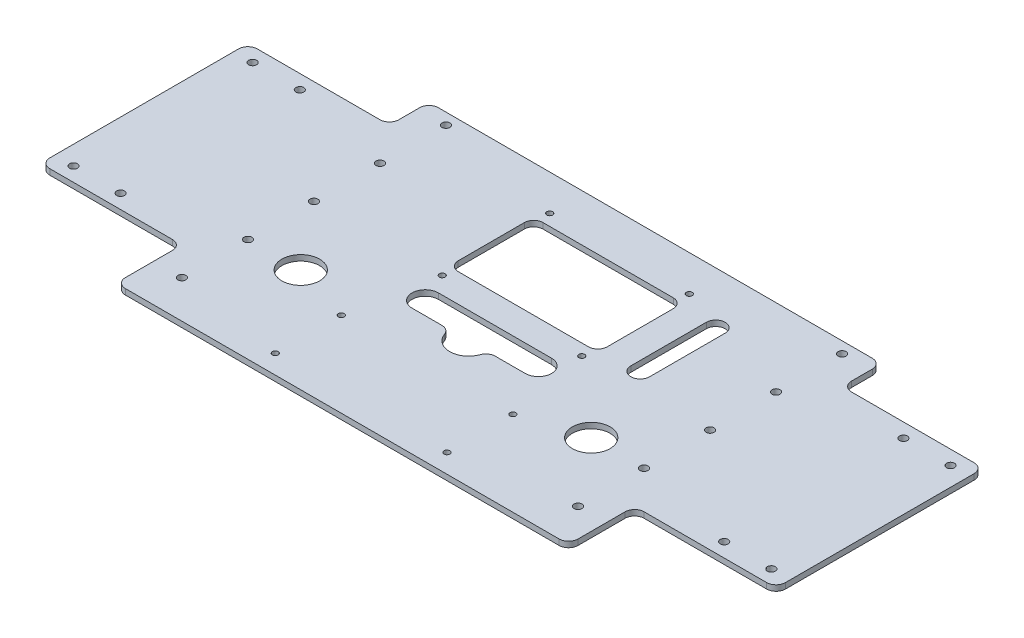
from build123d import *

# Parameters (mm, degrees)
SKETCH_1_W          = 240
SKETCH_1_H          = 166
EXTRUDE_1230_DEPTH  = 3
SKETCH_4_R          = 2.1
SKETCH_4_R_2        = 1.55
CUT_EXTRUDE_3_DEPTH = 251.068459046
SKETCH_5_R          = 1.55
SKETCH_5_R_2        = 10
SKETCH_5_W          = 79
SKETCH_5_H          = 45
CUT_EXTRUDE_4_DEPTH = 251.068459046
SKETCH_6_W          = 75
SKETCH_6_H          = 110
SKETCH_6_R          = 2.1
EXTRUDE_1_DEPTH     = 3
FILLET_1_R          = 5


with BuildPart() as part:
    # 草图1 → Extrude 1230 (new body)
    with BuildSketch(Plane(origin=(0, 0, 0), x_dir=(1, 0, 0), z_dir=(0, 1, 0))):
        with Locations((31.575924772, -115.871750732)):
            Rectangle(SKETCH_1_W, SKETCH_1_H)
    extrude(amount=EXTRUDE_1230_DEPTH)

    # 草图4 → 切除-拉伸3 (cut, through all)
    with BuildSketch(Plane(origin=(0, 3, 0), x_dir=(1, 0, 0), z_dir=(0, 1, 0))):
        with Locations(Location((-73.424075228, -73.871750732, 0), (0, 0, 270))):
            Circle(SKETCH_4_R)
        with Locations(Location((136.575924772, -178.871750732, 0), (0, 0, 90))):
            Circle(SKETCH_4_R)
        with Locations(Location((-73.424075228, -108.871750732, 0), (0, 0, 270))):
            Circle(SKETCH_4_R)
        with Locations(Location((-73.424075228, -143.871750732, 0), (0, 0, 270))):
            Circle(SKETCH_4_R)
        with Locations(Location((-73.424075228, -178.871750732, 0), (0, 0, 270))):
            Circle(SKETCH_4_R)
        with Locations(Location((136.575924772, -143.871750732, 0), (0, 0, 90))):
            Circle(SKETCH_4_R)
        with Locations(Location((136.575924772, -108.871750732, 0), (0, 0, 90))):
            Circle(SKETCH_4_R)
        with Locations(Location((136.575924772, -73.871750732, 0), (0, 0, 90))):
            Circle(SKETCH_4_R)
        with Locations(Location((-73.424075228, -38.871750732, 0), (0, 0, 270))):
            Circle(SKETCH_4_R)
        with Locations(Location((136.575924772, -38.871750732, 0), (0, 0, 90))):
            Circle(SKETCH_4_R)
        with Locations(Location((77.075924772, -188.871750732, 0), (0, 0, 270))):
            Circle(SKETCH_4_R_2)
        with Locations(Location((-13.924075228, -188.871750732, 0), (0, 0, 90))):
            Circle(SKETCH_4_R_2)
        with Locations(Location((77.075924772, -153.871750732, 0), (0, 0, 270))):
            Circle(SKETCH_4_R_2)
        with Locations(Location((-13.924075228, -153.871750732, 0), (0, 0, 90))):
            Circle(SKETCH_4_R_2)
    extrude(amount=-CUT_EXTRUDE_3_DEPTH, mode=Mode.SUBTRACT)

    # 草图5 → 切除-拉伸4 (cut, through all)
    with BuildSketch(Plane(origin=(0, 3, 0), x_dir=(1, 0, 0), z_dir=(0, 1, 0))):
        with Locations(Location((-5.424075228, -51.871750732, 0), (0, 0, 270))):
            Circle(SKETCH_5_R)
        with Locations(Location((68.575924772, -51.871750732, 0), (0, 0, 90))):
            Circle(SKETCH_5_R)
        with Locations(Location((68.575924772, -108.871750732, 0), (0, 0, 270))):
            Circle(SKETCH_5_R)
        with Locations(Location((-5.424075228, -108.871750732, 0), (0, 0, 90))):
            Circle(SKETCH_5_R)
        with Locations(Location((-45.424075228, -143.871750732, 0), (0, 0, 270))):
            Circle(SKETCH_5_R_2)
        with Locations(Location((108.575924772, -143.871750732, 0), (0, 0, 90))):
            Circle(SKETCH_5_R_2)
        with Locations((31.575924772, -80.371750732)):
            Rectangle(SKETCH_5_W, SKETCH_5_H)
        with BuildLine():
            Line((86.075924772, -100.371750732), (86.075924772, -60.371750732))
            ThreePointArc((86.075924772, -60.371750732), (91.075924772, -55.371750732), (96.075924772, -60.371750732))
            Line((96.075924772, -60.371750732), (96.075924772, -100.371750732))
            ThreePointArc((96.075924772, -100.371750732), (91.075924772, -105.371750732), (86.075924772, -100.371750732))
        make_face()
        with BuildLine():
            Line((1.575924772, -117.871750732), (61.575924772, -117.871750732))
            ThreePointArc((61.575924772, -117.871750732), (68.575924772, -124.871750732), (61.575924772, -131.871750732))
            Line((61.575924772, -131.871750732), (41.575924772, -131.871750732))
            ThreePointArc((41.575924772, -131.871750732), (31.575924772, -141.871750732), (21.575924772, -131.871750732))
            Line((21.575924772, -131.871750732), (1.575924772, -131.871750732))
            ThreePointArc((1.575924772, -131.871750732), (-5.424075228, -124.871750732), (1.575924772, -117.871750732))
        make_face()
    extrude(amount=-CUT_EXTRUDE_4_DEPTH, mode=Mode.SUBTRACT)

    # 草图6 → 凸台-拉伸1 (add)
    # profile 1 of 2: a face of its own
    with BuildSketch(Plane(origin=(0, 0, 0), x_dir=(1, 0, 0), z_dir=(0, 1, 0))):
        with Locations((-125.924075228, -108.871750732)):
            Rectangle(SKETCH_6_W, SKETCH_6_H)
        with Locations(Location((-153.424075228, -61.371750732, 0), (0, 0, 270))):
            Circle(SKETCH_6_R, mode=Mode.SUBTRACT)
        with Locations(Location((-153.424075228, -156.371750732, 0), (0, 0, 90))):
            Circle(SKETCH_6_R, mode=Mode.SUBTRACT)
        with Locations(Location((-128.424075228, -61.371750732, 0), (0, 0, 270))):
            Circle(SKETCH_6_R, mode=Mode.SUBTRACT)
        with Locations(Location((-128.424075228, -156.371750732, 0), (0, 0, 90))):
            Circle(SKETCH_6_R, mode=Mode.SUBTRACT)
    # profile 2 of 2: a face of its own
    with BuildSketch(Plane(origin=(0, 0, 0), x_dir=(1, 0, 0), z_dir=(0, 1, 0))):
        with Locations((189.075924772, -108.871750732)):
            Rectangle(SKETCH_6_W, SKETCH_6_H)
        with Locations(Location((216.575924772, -156.371750732, 0), (0, 0, 270))):
            Circle(SKETCH_6_R, mode=Mode.SUBTRACT)
        with Locations(Location((216.575924772, -61.371750732, 0), (0, 0, 90))):
            Circle(SKETCH_6_R, mode=Mode.SUBTRACT)
        with Locations(Location((191.575924772, -156.371750732, 0), (0, 0, 270))):
            Circle(SKETCH_6_R, mode=Mode.SUBTRACT)
        with Locations(Location((191.575924772, -61.371750732, 0), (0, 0, 90))):
            Circle(SKETCH_6_R, mode=Mode.SUBTRACT)
    extrude(amount=EXTRUDE_1_DEPTH)

    # 圆角1
    fillet_1_edges = [part.edges().sort_by_distance(p)[0] for p in [
        (41.575924772, 1.5, 131.871750732),
        (21.575924772, 1.5, 131.871750732),
        (-7.924075228, 1.5, 102.871750732),
        (-7.924075228, 1.5, 57.871750732),
        (71.075924772, 1.5, 57.871750732),
        (71.075924772, 1.5, 102.871750732),
        (-88.424075228, 1.5, 163.871750732),
        (-88.424075228, 1.5, 53.871750732),
        (-163.424075228, 1.5, 53.871750732),
        (-163.424075228, 1.5, 163.871750732),
        (226.575924772, 1.5, 53.871750732),
        (151.575924772, 1.5, 53.871750732),
        (151.575924772, 1.5, 163.871750732),
        (226.575924772, 1.5, 163.871750732),
        (-88.424075228, 1.5, 198.871750732),
        (-88.424075228, 1.5, 32.871750732),
        (151.575924772, 1.5, 32.871750732),
        (151.575924772, 1.5, 198.871750732),
    ]]
    fillet(fillet_1_edges, radius=FILLET_1_R)


solid = part.part
